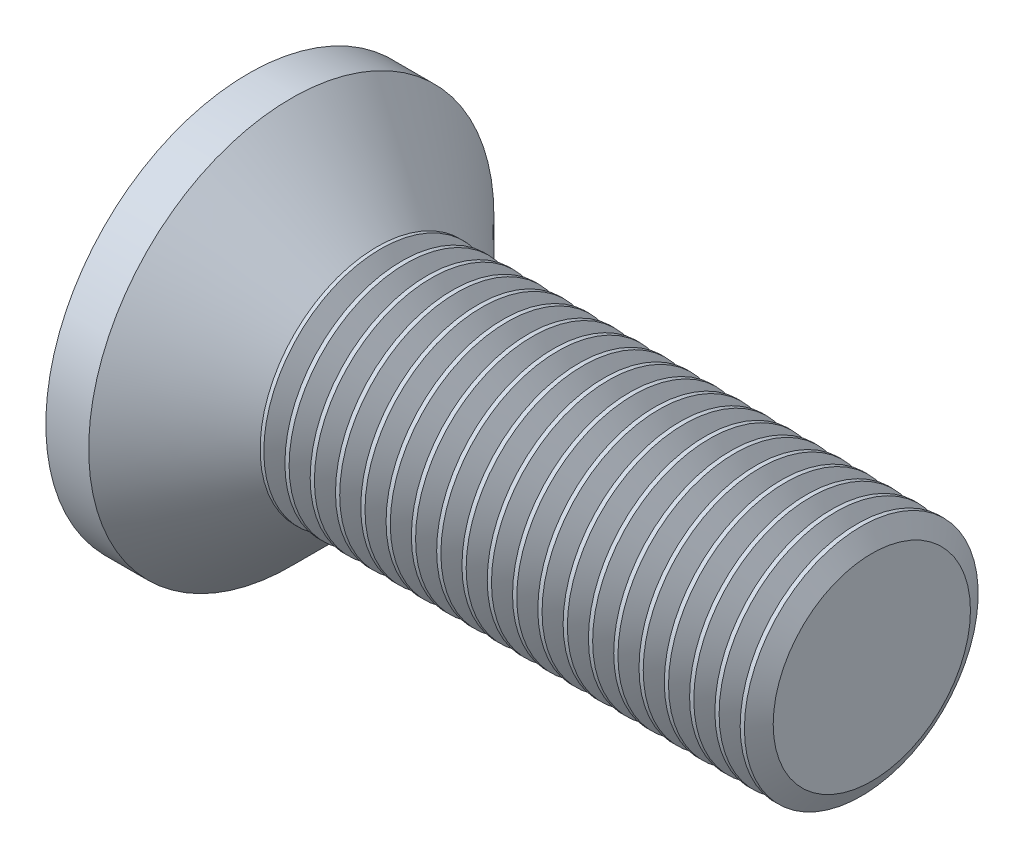
from build123d import *

# Parameters (mm, degrees)
CROSSRECESS_DEPTH = 0.825
DRAFT9_ANGLE      = 30
FILLET5_R         = 0.3
LPATTERN10_COUNT  = 20
LPATTERN10_PITCH  = 0.3246


with BuildPart() as part:
    # Sketch1 → Base (revolve)
    with BuildSketch(Plane.XY, mode=Mode.PRIVATE) as base_sk:
        Polygon((8, 1.5), (2.65, 1.5), (1.65, 1.5), (0.55, 2.6), (0, 2.6), (0, 0), (8, 0), align=None)
    revolve(base_sk.sketch.rotate(Axis((4.515812911, 0, 0), (-1, 0, 0)), 90), axis=Axis((4.515812911, 0, 0), (-1, 0, 0)))

    # Sketch6 → CrossRecess (cut)
    with BuildSketch(Plane(origin=(0, 0, 0), x_dir=(0, 0, -1), z_dir=(1, 0, 0))):
        Polygon((0.32, 0.32), (0.32, 1.6), (-0.32, 1.6), (-0.32, 0.32), (-1.6, 0.32), (-1.6, -0.32), (-0.32, -0.32), (-0.32, -1.6), (0.32, -1.6), (0.32, -0.32), (1.6, -0.32), (1.6, 0.32), align=None)
    extrude(amount=CROSSRECESS_DEPTH, mode=Mode.SUBTRACT)

    # Draft9
    draft9_faces = [part.faces().sort_by_distance(p)[0] for p in [
        (0.4125, 1.6, 0),
        (0.4125, 0, 1.6),
        (0.4125, -1.6, 0),
        (0.4125, 0, -1.6),
    ]]
    draft(draft9_faces, Plane(origin=(0, 2.6, 0), x_dir=(0, 0, -1), z_dir=(-1, 0, 0)), DRAFT9_ANGLE)

    # Fillet5
    fillet5_edges = [part.edges().sort_by_distance(p)[0] for p in [
        (0.4125, 0.32, 0.32),
        (0.4125, -0.32, 0.32),
        (0.4125, -0.32, -0.32),
        (0.4125, 0.32, -0.32),
    ]]
    fillet(fillet5_edges, radius=FILLET5_R)

    # Sketch9 → Cut-Revolve10 (revolve, cut)
    with BuildSketch(Plane.XY, mode=Mode.PRIVATE) as cut_revolve10_sk:
        Polygon((8, 1.265740128), (8.13525, 1.5), (8.13525, 1.7705), (7.86475, 1.7705), (7.86475, 1.5), align=None)
    cut_revolve10 = revolve(cut_revolve10_sk.sketch.rotate(Axis((0, 0, 0), (1, 0, 0)), 270), axis=Axis((0, 0, 0), (1, 0, 0)), mode=Mode.SUBTRACT)

    # LPattern10: Cut-Revolve10 ×20
    with Locations(*[(-i * LPATTERN10_PITCH, 0, 0) for i in range(1, LPATTERN10_COUNT)]):
        add(cut_revolve10, mode=Mode.SUBTRACT)


solid = part.part
